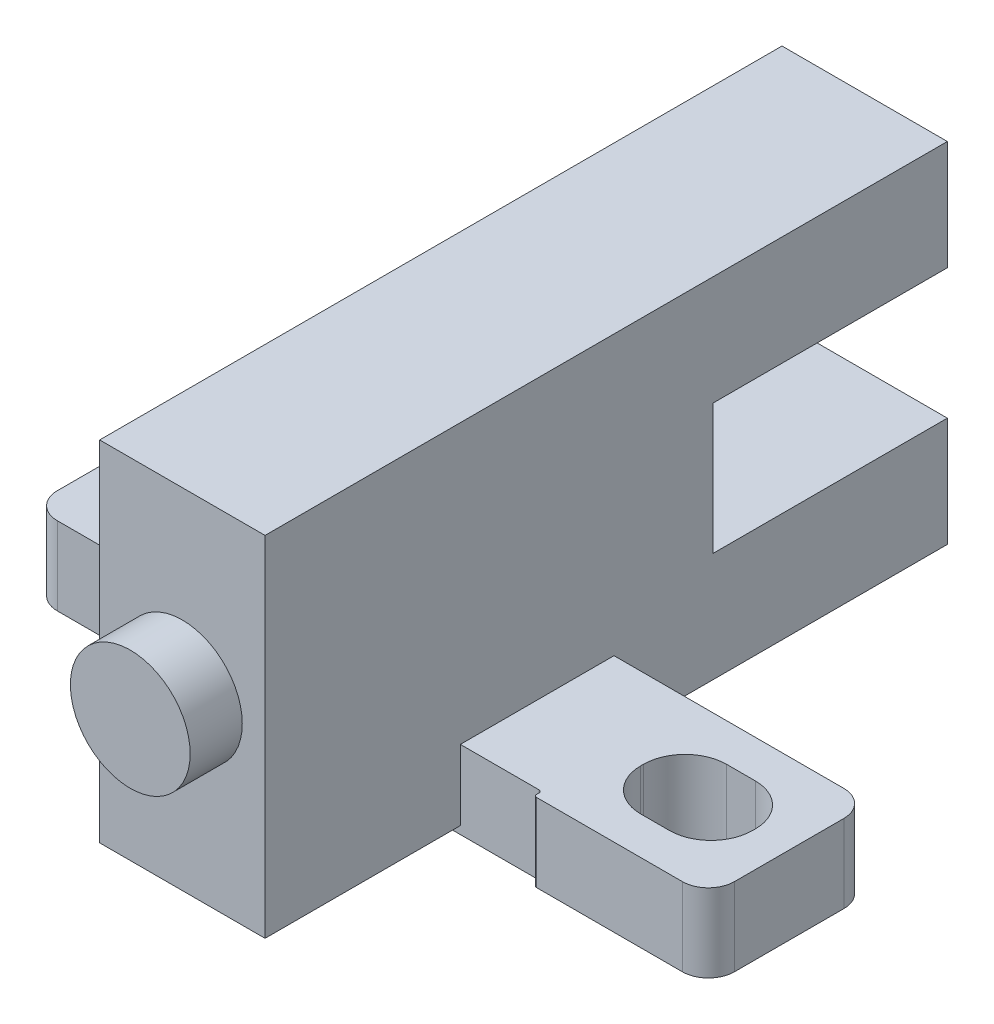
from build123d import *

# Parameters (mm, degrees)
EXTRUDE_1_DEPTH = 1.5
EXTRUDE_2_DEPTH = 3.175
SKETCH_9_R      = 2.3
EXTRUDE_3_DEPTH = 2


with BuildPart() as part:
    # 草图1 → 凸台-拉伸1 (new, symmetric)
    with BuildSketch(Plane(origin=(0, 0, 0), x_dir=(1, 0, 0), z_dir=(0, 1, 0))):
        with BuildLine():
            Line((-13, 2.1), (-13, -2.1))
            ThreePointArc((-13, -2.1), (-12.707106781, -2.807106781), (-12, -3.1))
            Line((-12, -3.1), (-6.4, -3.1))
            ThreePointArc((-6.4, -3.1), (-6.329289322, -3.070710678), (-6.3, -3))
            Line((-6.3, -3), (-6.3, -2.9))
            ThreePointArc((-6.3, -2.9), (-6.270710678, -2.829289322), (-6.2, -2.8))
            Line((-6.2, -2.8), (6.2, -2.8))
            ThreePointArc((6.2, -2.8), (6.270710678, -2.829289322), (6.3, -2.9))
            Line((6.3, -2.9), (6.3, -3))
            ThreePointArc((6.3, -3), (6.329289322, -3.070710678), (6.4, -3.1))
            Line((6.4, -3.1), (12, -3.1))
            ThreePointArc((12, -3.1), (12.707106781, -2.807106781), (13, -2.1))
            Line((13, -2.1), (13, 2.1))
            ThreePointArc((13, 2.1), (12.707106781, 2.807106781), (12, 3.1))
            Line((12, 3.1), (-12, 3.1))
            ThreePointArc((-12, 3.1), (-12.707106781, 2.807106781), (-13, 2.1))
        make_face()
        with BuildLine():
            Line((10.05, 1.65), (8.95, 1.65))
            ThreePointArc((8.95, 1.65), (7.81862915, 1.18137085), (7.35, 0.05))
            Line((7.35, 0.05), (7.35, -0.05))
            ThreePointArc((7.35, -0.05), (7.81862915, -1.18137085), (8.95, -1.65))
            Line((8.95, -1.65), (10.05, -1.65))
            ThreePointArc((10.05, -1.65), (11.18137085, -1.18137085), (11.65, -0.05))
            Line((11.65, -0.05), (11.65, 0.05))
            ThreePointArc((11.65, 0.05), (11.18137085, 1.18137085), (10.05, 1.65))
        make_face(mode=Mode.SUBTRACT)
        with BuildLine():
            Line((-10.05, 1.65), (-8.95, 1.65))
            ThreePointArc((-8.95, 1.65), (-7.81862915, 1.18137085), (-7.35, 0.05))
            Line((-7.35, 0.05), (-7.35, -0.05))
            ThreePointArc((-7.35, -0.05), (-7.81862915, -1.18137085), (-8.95, -1.65))
            Line((-8.95, -1.65), (-10.05, -1.65))
            ThreePointArc((-10.05, -1.65), (-11.18137085, -1.18137085), (-11.65, -0.05))
            Line((-11.65, -0.05), (-11.65, 0.05))
            ThreePointArc((-11.65, 0.05), (-11.18137085, 1.18137085), (-10.05, 1.65))
        make_face(mode=Mode.SUBTRACT)
    extrude(amount=EXTRUDE_1_DEPTH, both=True)

    # 草图8 → 凸台-拉伸2 (add, symmetric)
    with BuildSketch(Plane(origin=(0, 0, 0), x_dir=(0, 0, -1), z_dir=(1, 0, 0))):
        Polygon((6.9, 3), (6.9, 8), (15.9, 8), (15.9, 12.2), (-10.3, 12.2), (-10.3, -1.2), (15.9, -1.2), (15.9, 3), align=None)
    extrude(amount=EXTRUDE_2_DEPTH, both=True)

    # 草图9 → 凸台-拉伸3 (add)
    with BuildSketch(Plane.XY.offset(10.3)):
        with Locations((0, 5.5)):
            Circle(SKETCH_9_R)
    extrude(amount=EXTRUDE_3_DEPTH)


solid = part.part
